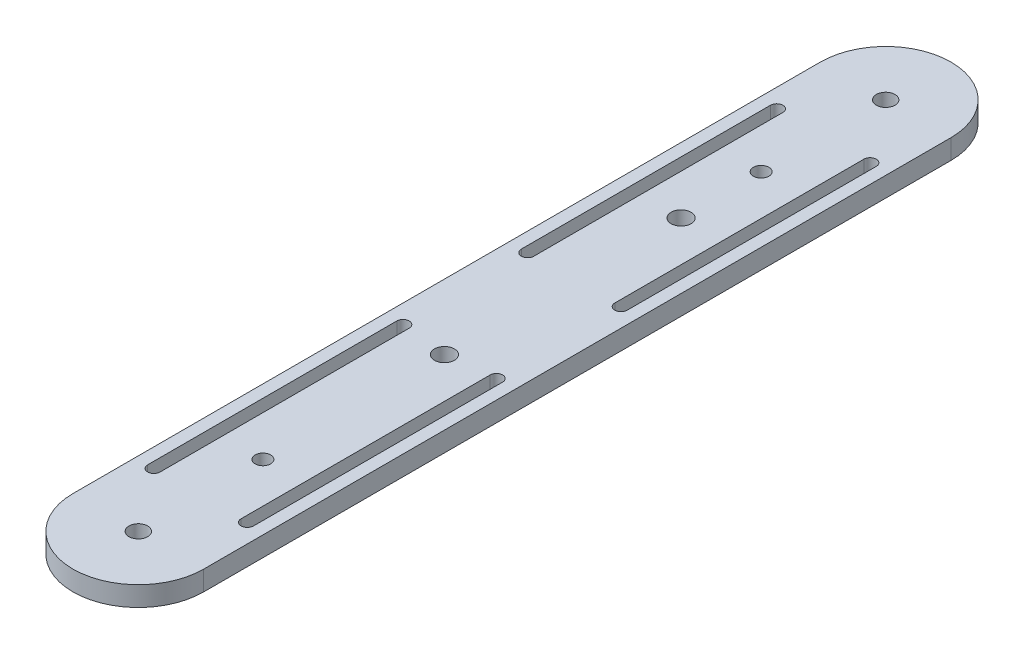
from build123d import *

# Parameters (mm, degrees)
SKETCH1_R               = 1.5
BOSS_EXTRUDE1_DEPTH     = 3.175
CUT_EXTRUDE1_DEPTH      = 131.960225355
CUT_EXTRUDE1_DEPTH_BACK = 131.960225355
CUT_EXTRUDE2_DEPTH      = 131.960225355
CUT_EXTRUDE2_DEPTH_BACK = 131.960225355
CUT_EXTRUDE4_DEPTH      = 40
SKETCH6_R               = 1.6
CUT_EXTRUDE5_DEPTH      = 10


with BuildPart() as part:
    # Sketch1 → Boss-Extrude1 (new body)
    with BuildSketch(Plane(origin=(0, 0, 0), x_dir=(1, 0, 0), z_dir=(0, 1, 0))):
        with BuildLine():
            Line((-10.5, 0), (-10.5, -120))
            ThreePointArc((-10.5, -120), (0, -130.5), (10.5, -120))
            Line((10.5, -120), (10.5, 0))
            ThreePointArc((10.5, 0), (0, 10.5), (-10.5, 0))
        make_face()
        with Locations(Location((0, 0, 0), (0, 0, 270))):
            Circle(SKETCH1_R, mode=Mode.SUBTRACT)
        with Locations(Location((0, -120, 0), (0, 0, 270))):
            Circle(SKETCH1_R, mode=Mode.SUBTRACT)
    extrude(amount=BOSS_EXTRUDE1_DEPTH)

    # Sketch2 → Cut-Extrude1 (cut, two sides: drawn at the far end of the back side and taken through both)
    with BuildSketch(Plane.XZ.offset(-CUT_EXTRUDE1_DEPTH_BACK)):
        with BuildLine():
            ThreePointArc((0, 18.75), (1.25, 20), (0, 21.25))
            ThreePointArc((0, 21.25), (-1.25, 20), (0, 18.75))
        make_face()
    extrude(amount=CUT_EXTRUDE1_DEPTH + CUT_EXTRUDE1_DEPTH_BACK, mode=Mode.SUBTRACT)

    # Sketch3 → Cut-Extrude2 (cut, two sides: drawn at the far end of the back side and taken through both)
    with BuildSketch(Plane(origin=(0, 3.175, 0), x_dir=(1, 0, 0), z_dir=(0, 1, 0)).offset(-CUT_EXTRUDE2_DEPTH_BACK)):
        with BuildLine():
            ThreePointArc((0, -98.75), (-1.25, -100), (0, -101.25))
            ThreePointArc((0, -101.25), (1.25, -100), (0, -98.75))
        make_face()
    extrude(amount=CUT_EXTRUDE2_DEPTH + CUT_EXTRUDE2_DEPTH_BACK, mode=Mode.SUBTRACT)

    # Sketch5 → Cut-Extrude4 (cut)
    with BuildSketch(Plane.XZ):
        with BuildLine():
            Line((-8.5, 10), (-8.5, 50))
            ThreePointArc((-8.5, 50), (-7.5, 51), (-6.5, 50))
            Line((-6.5, 50), (-6.5, 10))
            ThreePointArc((-6.5, 10), (-7.5, 9), (-8.5, 10))
        make_face()
        with BuildLine():
            Line((6.5, 50), (6.5, 10))
            ThreePointArc((6.5, 10), (7.5, 9), (8.5, 10))
            Line((8.5, 10), (8.5, 50))
            ThreePointArc((8.5, 50), (7.5, 51), (6.5, 50))
        make_face()
        with BuildLine():
            Line((8.5, 110), (8.5, 70))
            ThreePointArc((8.5, 70), (7.5, 69), (6.5, 70))
            Line((6.5, 70), (6.5, 110))
            ThreePointArc((6.5, 110), (7.5, 111), (8.5, 110))
        make_face()
        with BuildLine():
            Line((-6.5, 70), (-6.5, 110))
            ThreePointArc((-6.5, 110), (-7.5, 111), (-8.5, 110))
            Line((-8.5, 110), (-8.5, 70))
            ThreePointArc((-8.5, 70), (-7.5, 69), (-6.5, 70))
        make_face()
    extrude(amount=-CUT_EXTRUDE4_DEPTH, mode=Mode.SUBTRACT)

    # Sketch6 → Cut-Extrude5 (cut)
    with BuildSketch(Plane.XZ):
        with Locations(Location((0, 70.85, 0), (0, 0, 270))):
            Circle(SKETCH6_R)
        with Locations(Location((0, 32.85, 0), (0, 0, 270))):
            Circle(SKETCH6_R)
    extrude(amount=-CUT_EXTRUDE5_DEPTH, mode=Mode.SUBTRACT)


solid = part.part
